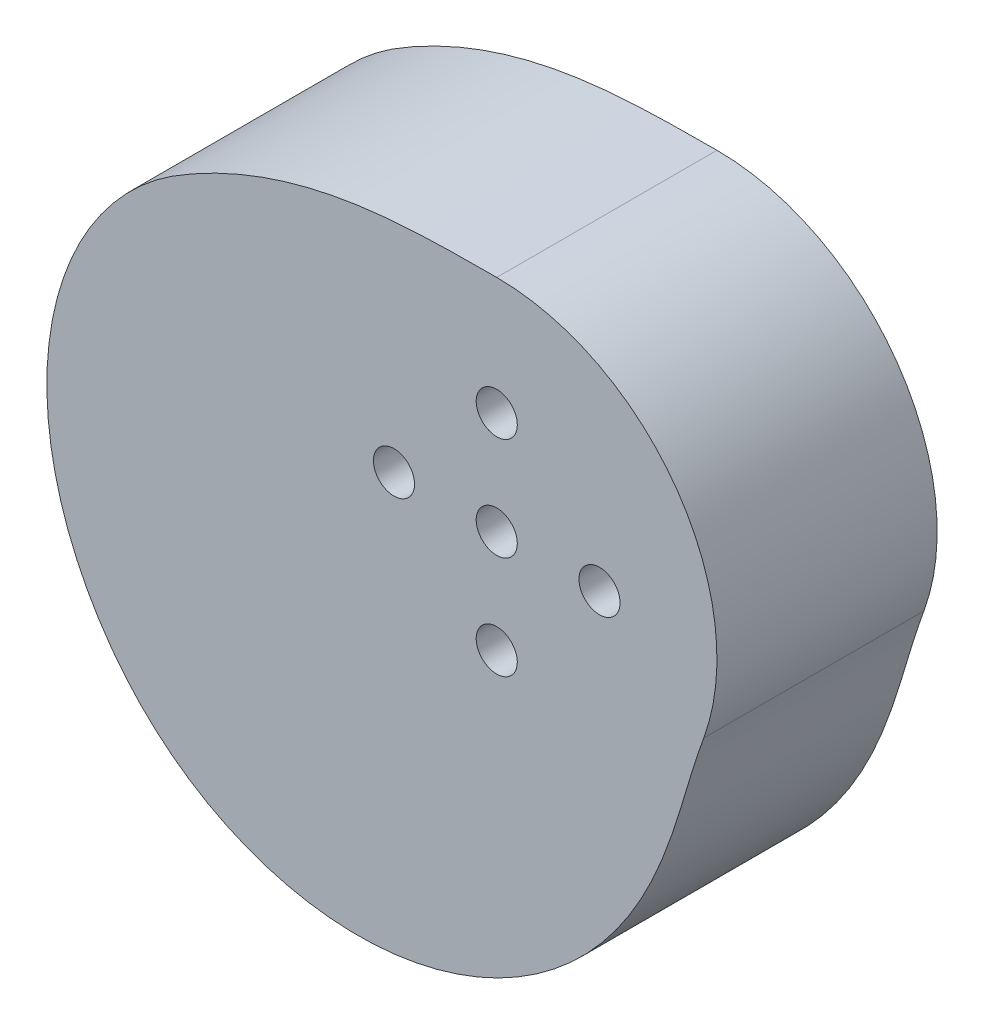
from build123d import *

# Parameters (mm, degrees)
EXTRUDE_1_DEPTH     = 15
SKETCH_3_R          = 1.4
CUT_EXTRUDE_2_DEPTH = 45.491091955


with BuildPart() as part:
    # 草图1 → 凸台-拉伸1 (new body)
    with BuildSketch(Plane.XY):
        with BuildLine():
            ThreePointArc((14.095389312, -5.13030215), (12.287280664, 8.603646545), (0, 15))
            add(Edge.make_bspline(
                [(0, 15), (-0.174596768, 14.999999319), (-0.436611581, 14.999693042), (-0.786186323, 14.998643785), (-1.048915847, 14.997519085), (-1.312216235, 14.99603471), (-1.576228693, 14.994161918), (-1.84109342, 14.991865662), (-2.106949414, 14.989104591), (-2.373934268, 14.985831089), (-2.642183971, 14.981991319), (-2.911832716, 14.977525266), (-3.1830127, 14.972366794), (-3.455853932, 14.966443701), (-3.730484039, 14.959677782), (-4.007028071, 14.9519849), (-4.285608318, 14.943275054), (-4.566344116, 14.933452466), (-4.849351664, 14.922415656), (-5.134743838, 14.910057537), (-5.422630012, 14.896265505), (-5.713115875, 14.880921543), (-6.006303259, 14.863902316), (-6.302289959, 14.84507929), (-6.601169567, 14.824318836), (-6.903031299, 14.801482354), (-7.207959833, 14.776426392), (-7.516035146, 14.749002775), (-7.827332351, 14.719058736), (-8.141921549, 14.686437053), (-8.459867669, 14.650976187), (-8.781230323, 14.612510428), (-9.106063662, 14.570870045), (-9.434416233, 14.525881438), (-9.766330843, 14.477367292), (-10.101844426, 14.425146744), (-10.440987913, 14.36903554), (-10.783786108, 14.30884621), (-11.130257567, 14.244388236), (-11.480414483, 14.175468229), (-11.834262574, 14.101890107), (-12.191800976, 14.023455277), (-12.553022141, 13.939962822), (-12.917911738, 13.851209688), (-13.286448564, 13.756990875), (-13.658604451, 13.657099633), (-14.03434419, 13.551327657), (-14.413625446, 13.439465288), (-14.796398691, 13.321301714), (-15.182607133, 13.196625177), (-15.572186657, 13.065223175), (-15.965065767, 12.926882676), (-16.361165533, 12.781390325), (-16.760399548, 12.62853266), (-17.162673883, 12.468096321), (-17.567887059, 12.299868276), (-17.975930009, 12.12363602), (-18.386686074, 11.939187837), (-18.800030904, 11.746312879), (-19.21583277, 11.544801919), (-19.63395132, 11.334445536), (-20.054242271, 11.115042096), (-20.476539575, 10.886368472), (-20.900723293, 10.648292485), (-21.326461435, 10.400346233), (-21.753514654, 10.143757392), (-22.178049863, 9.87535726), (-22.595959424, 9.592299141), (-23.006858872, 9.296248411), (-23.410215858, 8.987163154), (-23.805723663, 8.665361009), (-24.19302422, 8.331073979), (-24.571782966, 7.984568061), (-24.94166894, 7.626110759), (-25.302360391, 7.255979562), (-25.65354351, 6.874459377), (-25.994913004, 6.481842935), (-26.326172169, 6.078430394), (-26.647033089, 5.664529144), (-26.957216795, 5.240453567), (-27.256453426, 4.80652479), (-27.544482381, 4.363070443), (-27.82105247, 3.910424411), (-28.085922052, 3.448926584), (-28.338859169, 2.978922599), (-28.579641679, 2.500763586), (-28.808057373, 2.014805906), (-29.023904095, 1.521410888), (-29.226989847, 1.020944566), (-29.417132895, 0.513777409), (-29.594161862, 0.000284053), (-29.757915818, -0.519156969), (-29.908244365, -1.044163505), (-30.045007708, -1.574350056), (-30.168076728, -2.109328051), (-30.277333041, -2.648706129), (-30.372669056, -3.192090415), (-30.453988019, -3.739084801), (-30.521204062, -4.289291227), (-30.574242228, -4.842309963), (-30.613038507, -5.39773989), (-30.637539851, -5.955178784), (-30.647704191, -6.514223598), (-30.643500444, -7.074470745), (-30.624908509, -7.63551638), (-30.591919266, -8.196956684), (-30.544534557, -8.758388145), (-30.48276717, -9.319407838), (-30.406640805, -9.879613709), (-30.316190047, -10.438604851), (-30.21146032, -10.995981785), (-30.092507839, -11.551346736), (-29.95939956, -12.104303912), (-29.812213112, -12.654459772), (-29.651036733, -13.201423307), (-29.475969194, -13.744806302), (-29.287119719, -14.284223615), (-29.084607895, -14.819293432), (-28.868563581, -15.349637541), (-28.639126801, -15.874881588), (-28.396447646, -16.394655341), (-28.140686152, -16.908592941), (-27.872012186, -17.416333158), (-27.590605319, -17.917519643), (-27.296654692, -18.411801174), (-26.990358881, -18.898831896), (-26.671925755, -19.378271573), (-26.341572303, -19.849785794), (-25.885480421, -20.467504768), (-25.526267712, -20.917866263), (-25.279466623, -21.21199112)],
                knots=[0, 0, 0, 0, 0.008983592, 0.013481544, 0.017986876, 0.022502032, 0.027029448, 0.031571543, 0.036130722, 0.040709366, 0.045309838, 0.049934477, 0.054585593, 0.059265472, 0.063976367, 0.068720504, 0.073500073, 0.078317234, 0.083174111, 0.088072793, 0.093015336, 0.098003759, 0.103040044, 0.108126138, 0.113263955, 0.118455369, 0.123702222, 0.129006319, 0.134369433, 0.139793302, 0.145279632, 0.150830096, 0.156446337, 0.162129965, 0.167882565, 0.173705688, 0.179600863, 0.185569587, 0.191613334, 0.197733555, 0.203931674, 0.210209093, 0.216567194, 0.223007337, 0.229530862, 0.236139089, 0.242833322, 0.249614847, 0.256484933, 0.263444834, 0.270495789, 0.277639024, 0.284875752, 0.292207171, 0.299634469, 0.307158825, 0.314781404, 0.322503362, 0.330325849, 0.338250002, 0.346276954, 0.354407827, 0.362643738, 0.370985797, 0.379435108, 0.387992769, 0.396619209, 0.405274739, 0.413959558, 0.422673829, 0.431417677, 0.440191194, 0.448994436, 0.457827427, 0.466690157, 0.475582587, 0.484504647, 0.493456237, 0.50243723, 0.511447469, 0.520486775, 0.529554938, 0.538651727, 0.547776885, 0.556930133, 0.566111169, 0.575319669, 0.584555288, 0.593817663, 0.603106409, 0.612421123, 0.621761385, 0.631126755, 0.64051678, 0.649930987, 0.659368891, 0.66882999, 0.678313767, 0.687819694, 0.697347228, 0.706895812, 0.71646488, 0.726053851, 0.735662137, 0.745289135, 0.754934234, 0.764596814, 0.774276244, 0.783971886, 0.793683092, 0.803409207, 0.813149569, 0.822903507, 0.832670344, 0.8424494, 0.852239983, 0.862041401, 0.871852953, 0.881673937, 0.891503642, 0.901341356, 0.911186363, 0.921037943, 0.930895373, 0.940757928, 0.95062488, 0.960495499, 0.970369054, 0.980244811, 1, 1, 1, 1], degree=3))
            add(Edge.make_bspline(
                [(-25.279466623, -21.21199112), (-25.03266702, -21.506118015), (-24.650058643, -21.936850324), (-24.116326131, -22.48889957), (-23.704647777, -22.89139552), (-23.281933222, -23.282038607), (-22.848561661, -23.660506241), (-22.404923763, -24.026490317), (-21.951421131, -24.379697722), (-21.48846567, -24.719850743), (-21.016478952, -25.046687464), (-20.535891561, -25.359962134), (-20.047142425, -25.659445508), (-19.550678137, -25.944925156), (-19.04695226, -26.216205747), (-18.536424623, -26.4731093), (-18.019560603, -26.715475403), (-17.496830406, -26.943161412), (-16.968708336, -27.156042604), (-16.435672059, -27.354012309), (-15.898201862, -27.536982008), (-15.35677991, -27.704881402), (-14.811889501, -27.857658441), (-14.264014323, -27.995279333), (-13.713637708, -28.117728512), (-13.161241887, -28.225008578), (-12.607307258, -28.317140209), (-12.052311649, -28.394162034), (-11.496729594, -28.456130483), (-10.941031611, -28.5031196), (-10.385683496, -28.535220833), (-9.831145623, -28.552542784), (-9.277872252, -28.555210939), (-8.726310862, -28.543367367), (-8.176901485, -28.517170386), (-7.630076062, -28.476794208), (-7.086257816, -28.422428554), (-6.545860639, -28.354278239), (-6.009288499, -28.272562744), (-5.476934872, -28.177515748), (-4.949182183, -28.069384646), (-4.426401286, -27.948430045), (-3.908950946, -27.814925234), (-3.397177365, -27.669155633), (-2.891413716, -27.511418228), (-2.391979716, -27.342020982), (-1.899181211, -27.161282232), (-1.413309805, -26.969530066), (-0.934642496, -26.767101692), (-0.463441361, -26.554342786), (4.6748e-05, -26.331606829), (0.455590466, -26.099254437), (0.902974156, -25.857652676), (1.341998114, -25.607174371), (1.77247875, -25.348197408), (2.194248731, -25.081104026), (2.607157097, -24.806280109), (3.011069352, -24.524114474), (3.405867507, -24.234998154), (3.791450116, -23.939323681), (4.167732256, -23.637484373), (4.534645494, -23.329873622), (4.892137816, -23.016884179), (5.240173528, -22.698907455), (5.578733117, -22.376332816), (5.907813101, -22.049546899), (6.22742583, -21.71893292), (6.537599266, -21.384870008), (6.838376738, -21.047732541), (7.129816662, -20.707889495), (7.411992235, -20.365703811), (7.684991105, -20.021531772), (7.948915008, -19.675722401), (8.20387939, -19.32861687), (8.450012994, -18.980547932), (8.687457427, -18.631839373), (8.916366703, -18.282805481), (9.136906768, -17.933750534), (9.349254998, -17.58496832), (9.553599678, -17.236741672), (9.750139466, -16.889342026), (9.939082834, -16.543029011), (10.120647493, -16.198050057), (10.295059808, -15.854640037), (10.462554187, -15.513020927), (10.623372469, -15.173401503), (10.777763289, -14.835977057), (10.925981441, -14.50092915), (11.068287227, -14.168425389), (11.204945795, -13.838619231), (11.336226478, -13.511649827), (11.462402118, -13.187641886), (11.583748391, -12.866705573), (11.70054313, -12.548936438), (11.813065642, -12.234415378), (11.921596028, -11.923208621), (12.026414502, -11.615367753), (12.127800711, -11.310929767), (12.226033064, -11.009917143), (12.321388061, -10.712337965), (12.414139626, -10.418186058), (12.504558455, -10.127441167), (12.592911364, -9.840069152), (12.679460654, -9.556022225), (12.76446348, -9.275239204), (12.848171238, -8.997645806), (12.93082896, -8.723154954), (13.01267473, -8.451667126), (13.093939106, -8.183070715), (13.174844564, -7.917242422), (13.255604965, -7.654047671), (13.336425025, -7.393341046), (13.417499824, -7.134966749), (13.49901432, -6.87875908), (13.581142893, -6.624542932), (13.664048917, -6.372134315), (13.747884322, -6.121340875), (13.832789331, -5.871962488), (13.947500586, -5.541332702), (14.035654827, -5.294414261), (14.095389312, -5.13030215)],
                knots=[0, 0, 0, 0, 0.021270399, 0.031903677, 0.042534645, 0.053162531, 0.063786554, 0.074405932, 0.085019874, 0.095627584, 0.106228257, 0.116821079, 0.127405228, 0.137979868, 0.148544155, 0.15909723, 0.169638222, 0.180166248, 0.190680407, 0.201179787, 0.211663457, 0.222130473, 0.232579872, 0.243010676, 0.253421887, 0.263812492, 0.27418146, 0.284527741, 0.294850266, 0.30514795, 0.315419689, 0.32566436, 0.335880824, 0.346067921, 0.356224476, 0.366349296, 0.376441173, 0.386498878, 0.396521172, 0.406506796, 0.416454478, 0.426362934, 0.436230863, 0.446056956, 0.45583989, 0.465578331, 0.475270938, 0.48491636, 0.49451324, 0.504060215, 0.513555916, 0.522998973, 0.532388013, 0.541721663, 0.550998551, 0.560217309, 0.569376572, 0.578474983, 0.587511192, 0.596483859, 0.605391658, 0.614233274, 0.623007411, 0.631712789, 0.640348151, 0.64891226, 0.657403907, 0.66582191, 0.674165115, 0.682432404, 0.690622694, 0.69873494, 0.706768137, 0.714721328, 0.7225936, 0.730384093, 0.738092, 0.745716573, 0.753257123, 0.760713027, 0.76808373, 0.775368751, 0.782567685, 0.789680206, 0.796706075, 0.803645143, 0.810497353, 0.81726275, 0.823941479, 0.830533798, 0.837040075, 0.8434608, 0.849796585, 0.856048172, 0.86221644, 0.868302406, 0.874307234, 0.880232236, 0.886078882, 0.891848803, 0.897543794, 0.903165817, 0.908717009, 0.914199683, 0.919616328, 0.924969613, 0.930262387, 0.935497677, 0.94067869, 0.945808804, 0.950891568, 0.955930696, 0.960930056, 0.965893662, 0.970825666, 0.975730339, 0.980612064, 0.985475315, 0.990324642, 1, 1, 1, 1], degree=3))
        make_face()
    extrude(amount=EXTRUDE_1_DEPTH)

    # 草图3 → 切除-拉伸2 (cut, through all)
    with BuildSketch(Plane.XY.offset(15)):
        Circle(SKETCH_3_R)
        with Locations((7, 0)):
            Circle(SKETCH_3_R)
        with Locations((0, -7)):
            Circle(SKETCH_3_R)
        with Locations((-7, 0)):
            Circle(SKETCH_3_R)
        with Locations((0, 7)):
            Circle(SKETCH_3_R)
    extrude(amount=-CUT_EXTRUDE_2_DEPTH, mode=Mode.SUBTRACT)


solid = part.part
